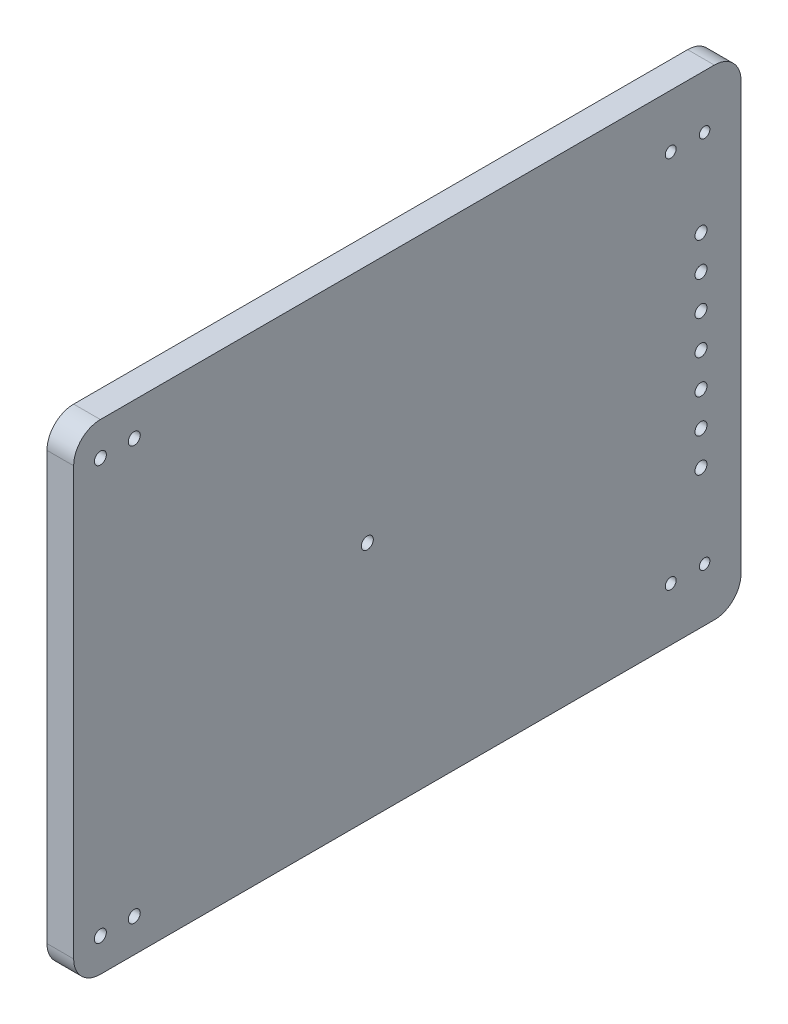
from build123d import *

# Parameters (mm, degrees)
EXTRUDE_1_DEPTH        = 1
SKETCH_2_R             = 0.45
CUT_EXTRUDE_1_DEPTH    = 2
SKETCH_3_R             = 0.45
CUT_EXTRUDE_2_DEPTH    = 2
PATTERN_LINEAR_1_COUNT = 7
PATTERN_LINEAR_1_PITCH = 2.54
SKETCH_4_R             = 0.45
CUT_EXTRUDE_3_DEPTH    = 2
SKETCH_5_R             = 0.39487869
SKETCH_5_R_2           = 0.408155613
CUT_EXTRUDE_4_DEPTH    = 2


with BuildPart() as part:
    # 草图1 → 凸台-拉伸1 (new, symmetric)
    with BuildSketch(Plane(origin=(0, 0, 0), x_dir=(0, 0, -1), z_dir=(1, 0, 0))):
        with BuildLine():
            Line((-23, 18), (23, 18))
            ThreePointArc((23, 18), (24.414213562, 17.414213562), (25, 16))
            Line((25, 16), (25, -16))
            ThreePointArc((25, -16), (24.414213562, -17.414213562), (23, -18))
            Line((23, -18), (-23, -18))
            ThreePointArc((-23, -18), (-24.414213562, -17.414213562), (-25, -16))
            Line((-25, -16), (-25, 16))
            ThreePointArc((-25, 16), (-24.414213562, 17.414213562), (-23, 18))
        make_face()
    extrude(amount=EXTRUDE_1_DEPTH, both=True)

    # 草图2 → 切除-拉伸1 (cut)
    with BuildSketch(Plane(origin=(1, 0, 0), x_dir=(0, 0, -1), z_dir=(1, 0, 0))):
        with Locations((-23, 15.5)):
            Circle(SKETCH_2_R)
        with Locations((-20.46, 15.5)):
            Circle(SKETCH_2_R)
    cut_extrude_1 = extrude(amount=-CUT_EXTRUDE_1_DEPTH, mode=Mode.SUBTRACT)

    # 镜向1: 切除-拉伸1 across plane
    add(cut_extrude_1.mirror(Plane.ZX), mode=Mode.SUBTRACT)

    # 草图3 → 切除-拉伸2 (cut)
    with BuildSketch(Plane(origin=(1, 0, 0), x_dir=(0, 0, -1), z_dir=(1, 0, 0))):
        with Locations((22, 7.62)):
            Circle(SKETCH_3_R)
    cut_extrude_2 = extrude(amount=-CUT_EXTRUDE_2_DEPTH, mode=Mode.SUBTRACT)

    # 阵列(线性)1: 切除-拉伸2 ×7
    with Locations(*[(0, -i * PATTERN_LINEAR_1_PITCH, 0) for i in range(1, PATTERN_LINEAR_1_COUNT)]):
        add(cut_extrude_2, mode=Mode.SUBTRACT)

    # 草图4 → 切除-拉伸3 (cut)
    with BuildSketch(Plane(origin=(1, 0, 0), x_dir=(0, 0, -1), z_dir=(1, 0, 0))):
        with Locations((-3, 0)):
            Circle(SKETCH_4_R)
    extrude(amount=-CUT_EXTRUDE_3_DEPTH, mode=Mode.SUBTRACT)

    # 草图5 → 切除-拉伸4 (cut)
    with BuildSketch(Plane(origin=(1, 0, 0), x_dir=(0, 0, -1), z_dir=(1, 0, 0))):
        with Locations((22.27, 14)):
            Circle(SKETCH_5_R)
        with Locations((19.73, 14)):
            Circle(SKETCH_5_R_2)
    cut_extrude_4 = extrude(amount=-CUT_EXTRUDE_4_DEPTH, mode=Mode.SUBTRACT)

    # 镜向2: 切除-拉伸4 across plane
    add(cut_extrude_4.mirror(Plane.ZX), mode=Mode.SUBTRACT)


solid = part.part
